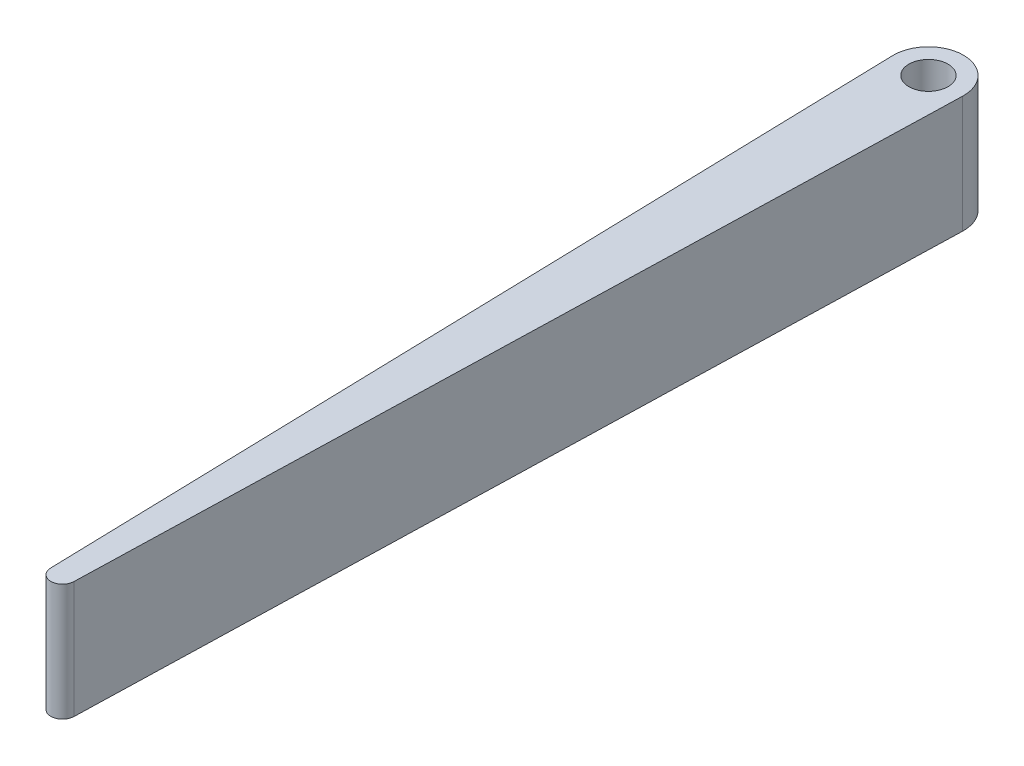
from build123d import *

# Parameters (mm, degrees)
SKETCH_1_R      = 3.35
EXTRUDE_1_DEPTH = 20


with BuildPart() as part:
    # 草图1 → 凸台-拉伸1 (new body)
    with BuildSketch(Plane(origin=(0, 0, 0), x_dir=(1, 0, 0), z_dir=(0, 1, 0))):
        with BuildLine():
            Line((-5.997922074, -0.157894881), (-2.104603424, -148.052632133))
            ThreePointArc((-2.104603424, -148.052632133), (-0.106718985, -150), (1.893934378, -148.055476932))
            Line((1.893934378, -148.055476932), (5.99769133, -0.166429278))
            ThreePointArc((5.99769133, -0.166429278), (0.004268758, 5.999998481), (-5.997922074, -0.157894881))
        make_face()
        with Locations(Location((0, 0, 0), (0, 0, 270))):
            Circle(SKETCH_1_R, mode=Mode.SUBTRACT)
    extrude(amount=EXTRUDE_1_DEPTH)


solid = part.part
